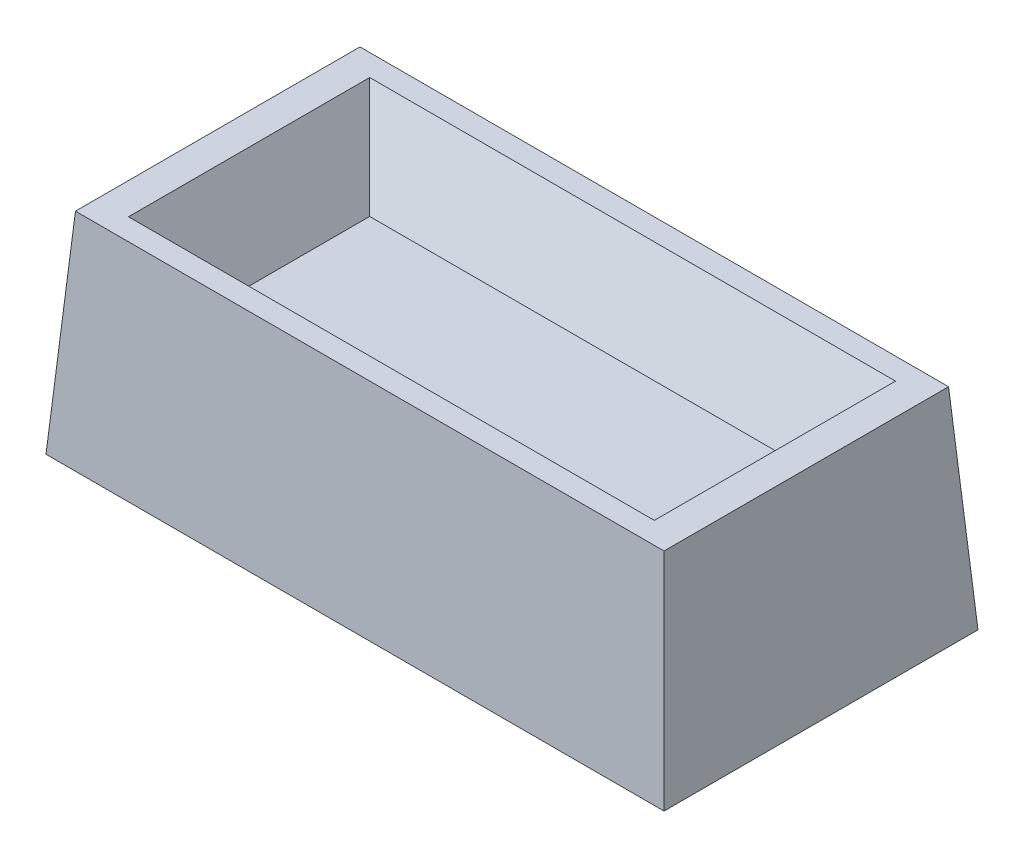
from build123d import *

# Parameters (mm, degrees)
SKETCH1_W           = 205.785682804
SKETCH1_H           = 104.534748446
BOSS_EXTRUDE1_DEPTH = 70.104
BOSS_EXTRUDE1_TAPER = 4
SKETCH2_W           = 145.758865666
SKETCH2_H           = 50.974097726
CUT_EXTRUDE1_DEPTH  = 25.4
DRAFT1_ANGLE        = 30


with BuildPart() as part:
    # Sketch1 → Boss-Extrude1 (new body)
    with BuildSketch(Plane(origin=(0, 0, 0), x_dir=(1, 0, 0), z_dir=(0, 1, 0))):
        Rectangle(SKETCH1_W, SKETCH1_H)
    extrude(amount=BOSS_EXTRUDE1_DEPTH, taper=BOSS_EXTRUDE1_TAPER)

    # Sketch2 → Cut-Extrude1 (cut)
    with BuildSketch(Plane(origin=(0, 70.104, 0), x_dir=(1, 0, 0), z_dir=(0, 1, 0))):
        Rectangle(SKETCH2_W, SKETCH2_H)
    extrude(amount=-CUT_EXTRUDE1_DEPTH, mode=Mode.SUBTRACT)

    # Draft1
    draft1_faces = [part.faces().sort_by_distance(p)[0] for p in [
        (0, 57.404, 25.487048863),
        (72.879432833, 57.404, 0),
        (0, 57.404, -25.487048863),
        (-72.879432833, 57.404, 0),
    ]]
    draft(draft1_faces, Plane.ZX.offset(44.704), DRAFT1_ANGLE)


solid = part.part
